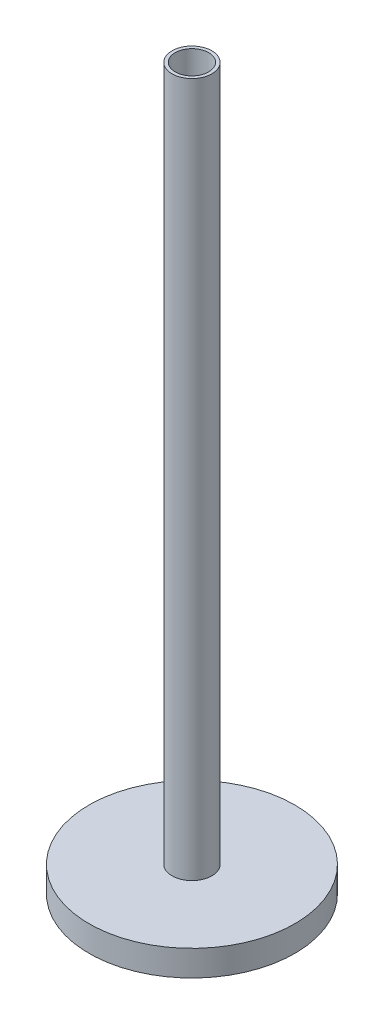
from build123d import *

# Parameters (mm, degrees)
SKETCH1_R           = 7.75
SKETCH1_R_2         = 6.5
BOSS_EXTRUDE1_DEPTH = 270
BOSS_EXTRUDE2_START = 10
SKETCH2_R           = 40.000518223
SKETCH2_R_2         = 7.75
BOSS_EXTRUDE2_DEPTH = 10
BOSS_EXTRUDE3_START = -20.476429663
SKETCH1_2_R         = 7.75
SKETCH1_2_R_2       = 6.5
BOSS_EXTRUDE3_DEPTH = 20.476429663


with BuildPart() as part:
    # Sketch1 → Boss-Extrude1 (new body)
    with BuildSketch(Plane(origin=(0, 0, 0), x_dir=(1, 0, 0), z_dir=(0, 1, 0))):
        Circle(SKETCH1_R)
        Circle(SKETCH1_R_2, mode=Mode.SUBTRACT)
    extrude(amount=BOSS_EXTRUDE1_DEPTH)

    # Sketch1<2> → Boss-Extrude3 (add)
    with BuildSketch(Plane(origin=(0, 0, 0), x_dir=(1, 0, 0), z_dir=(0, 1, 0)).offset(BOSS_EXTRUDE3_START)):
        Circle(SKETCH1_2_R)
        Circle(SKETCH1_2_R_2, mode=Mode.SUBTRACT)
    extrude(amount=BOSS_EXTRUDE3_DEPTH)


with BuildPart() as body_2:
    # Sketch2 → Boss-Extrude2 (new body)
    with BuildSketch(Plane(origin=(0, 0, 0), x_dir=(-1, 0, 0), z_dir=(0, -1, 0)).offset(BOSS_EXTRUDE2_START)):
        Circle(SKETCH2_R)
        Circle(SKETCH2_R_2, mode=Mode.SUBTRACT)
    extrude(amount=-BOSS_EXTRUDE2_DEPTH)


solid = Compound([part.part, body_2.part])
